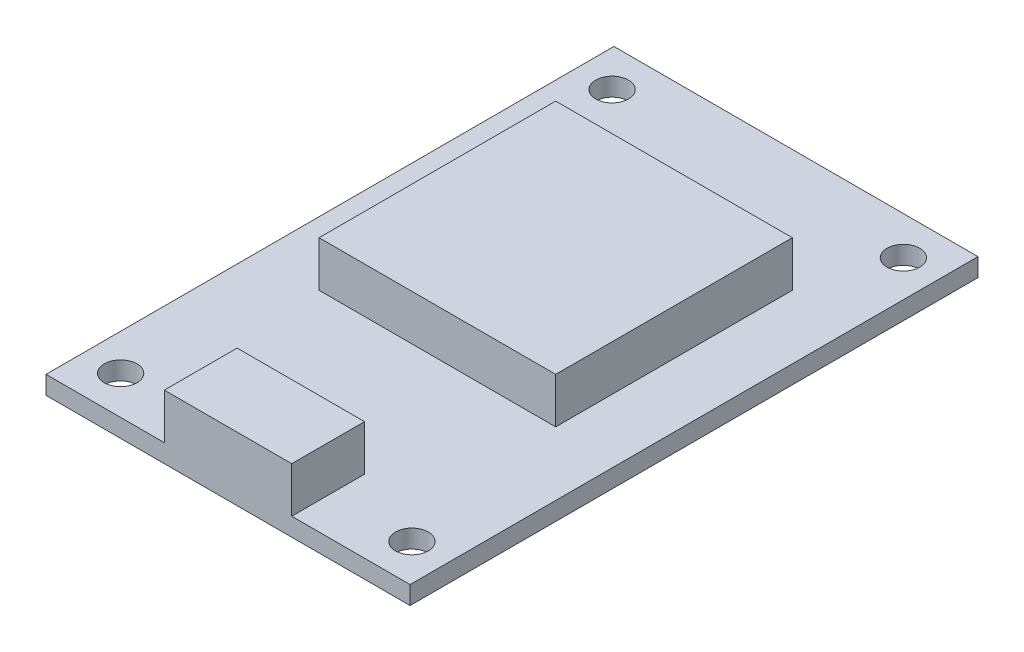
from build123d import *

# Parameters (mm, degrees)
SKETCH1_W           = 25.4
SKETCH1_H           = 39.624
SKETCH1_R           = 1.143
BOSS_EXTRUDE1_DEPTH = 1.27
SKETCH2_W           = 16.51
SKETCH2_H           = 16.51
BOSS_EXTRUDE2_DEPTH = 3.175
SKETCH3_W           = 8.89
SKETCH3_H           = 5.08
BOSS_EXTRUDE3_DEPTH = 3.175


with BuildPart() as part:
    # Sketch1 → Boss-Extrude1 (new body)
    with BuildSketch(Plane(origin=(0, 0, 0), x_dir=(1, 0, 0), z_dir=(0, 1, 0))):
        Rectangle(SKETCH1_W, SKETCH1_H)
        with Locations(Location((10.16, 17.145, 0), (0, 0, 270))):
            Circle(SKETCH1_R, mode=Mode.SUBTRACT)
        with Locations(Location((-10.16, 17.145, 0), (0, 0, 270))):
            Circle(SKETCH1_R, mode=Mode.SUBTRACT)
        with Locations(Location((-10.16, -17.145, 0), (0, 0, 270))):
            Circle(SKETCH1_R, mode=Mode.SUBTRACT)
        with Locations(Location((10.16, -17.145, 0), (0, 0, 270))):
            Circle(SKETCH1_R, mode=Mode.SUBTRACT)
    extrude(amount=BOSS_EXTRUDE1_DEPTH)

    # Sketch2 → Boss-Extrude2 (add)
    with BuildSketch(Plane(origin=(0, 1.27, 0), x_dir=(1, 0, 0), z_dir=(0, 1, 0))):
        with Locations((0, 3.048)):
            Rectangle(SKETCH2_W, SKETCH2_H)
    extrude(amount=BOSS_EXTRUDE2_DEPTH)

    # Sketch3 → Boss-Extrude3 (add)
    with BuildSketch(Plane(origin=(0, 1.27, 0), x_dir=(1, 0, 0), z_dir=(0, 1, 0))):
        with Locations((0, -17.272)):
            Rectangle(SKETCH3_W, SKETCH3_H)
    extrude(amount=BOSS_EXTRUDE3_DEPTH)


solid = part.part
